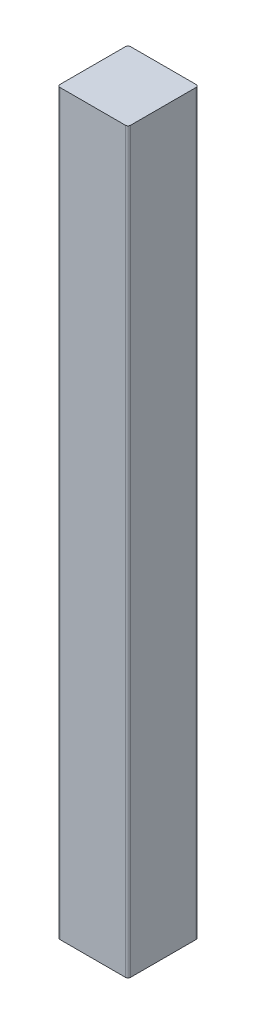
from build123d import *

# Parameters (mm, degrees)
SKETCH1_W           = 88.9
SKETCH1_H           = 88.9
BOSS_EXTRUDE1_DEPTH = 928.6875
FILLET1_R           = 3.175


with BuildPart() as part:
    # Sketch1 → Boss-Extrude1 (new body)
    with BuildSketch(Plane(origin=(0, 0, 0), x_dir=(1, 0, 0), z_dir=(0, 1, 0))):
        Rectangle(SKETCH1_W, SKETCH1_H)
    extrude(amount=BOSS_EXTRUDE1_DEPTH)

    # Fillet1
    fillet1_edges = [part.edges().sort_by_distance(p)[0] for p in [
        (44.45, 464.34375, 44.45),
        (-44.45, 464.34375, 44.45),
        (-44.45, 464.34375, -44.45),
        (44.45, 464.34375, -44.45),
    ]]
    fillet(fillet1_edges, radius=FILLET1_R)


solid = part.part
